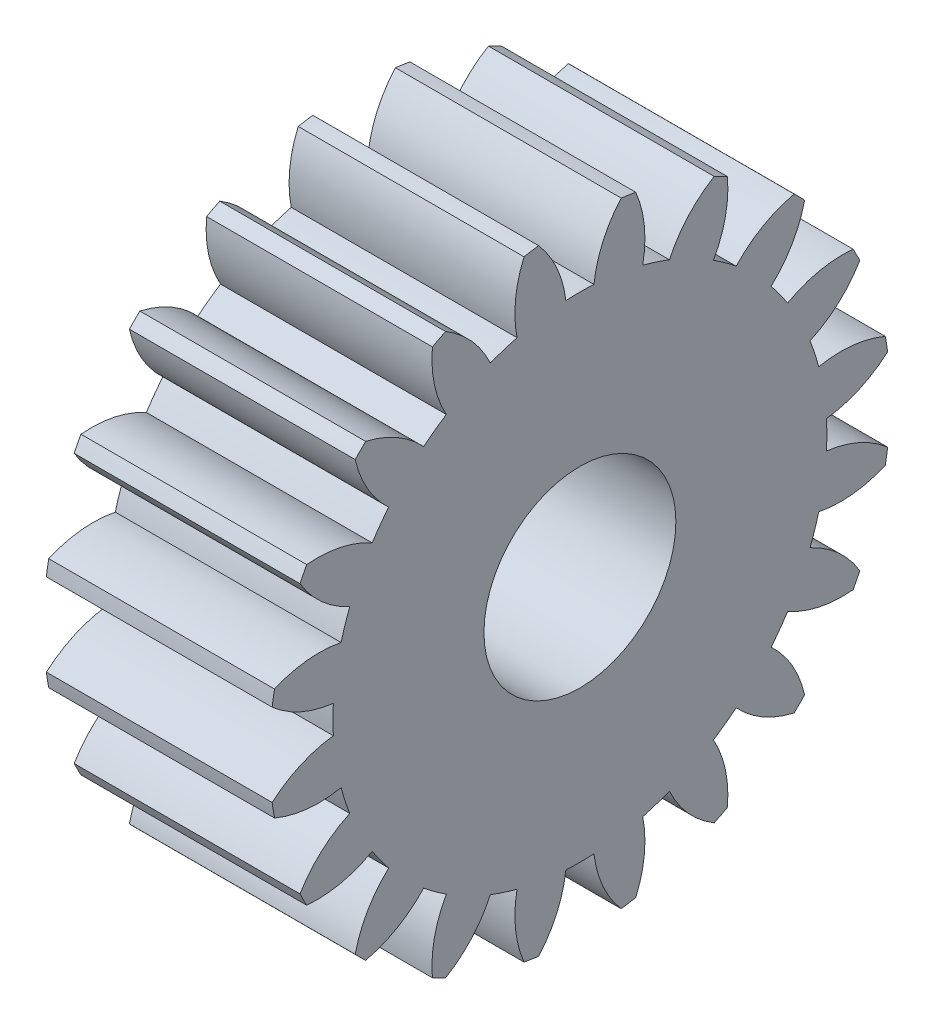
from build123d import *

# Parameters (mm, degrees)
BASPROSKE_W         = 10
BASPROSKE_H         = 13.75
TOOTHCUT_DEPTH      = 22.866069606
TEETHCUTS_COUNT     = 20
TEETHCUTS_ANGLE     = 342
BORSKE_R            = 2
BORE_DEPTH          = 50.0000508
SKETCH2_R           = 2
BOSS_EXTRUDE1_DEPTH = 10
SKETCH3_R           = 4.25
CUT_EXTRUDE2_DEPTH  = 10


with BuildPart() as part:
    # BasProSke → Base-Revolve (revolve)
    with BuildSketch(Plane(origin=(0, 0, 0), x_dir=(1, 0, 0), z_dir=(0, 1, 0)), mode=Mode.PRIVATE) as base_revolve_sk:
        with Locations((5, 6.875)):
            Rectangle(BASPROSKE_W, BASPROSKE_H)
    revolve(base_revolve_sk.sketch.rotate(Axis((-10, 0, 0), (1, 0, 0)), 180), axis=Axis((-10, 0, 0), (1, 0, 0)))

    # TooCutSke → ToothCut (cut, through all)
    with BuildSketch(Plane(origin=(0, 0, 0), x_dir=(0, 0, -1), z_dir=(1, 0, 0))):
        with BuildLine():
            ThreePointArc((0.62110296, 10.918848994), (0, 10.9365), (-0.62110296, 10.918848994))
            ThreePointArc((-0.62110296, 10.918848994), (-1.024517052, 12.378857135), (-1.846615859, 13.651067908))
            ThreePointArc((-1.846615859, 13.651067908), (0, 13.7754), (1.846615859, 13.651067908))
            ThreePointArc((1.846615859, 13.651067908), (1.024517052, 12.378857135), (0.62110296, 10.918848994))
        make_face()
    toothcut = extrude(amount=TOOTHCUT_DEPTH, mode=Mode.SUBTRACT)

    # TeethCuts: ToothCut ×20 about axis
    teethcuts_axis = Axis((-10, 0, 0), (1, 0, 0))
    for i in range(1, TEETHCUTS_COUNT):
        add(toothcut.rotate(teethcuts_axis, i * TEETHCUTS_ANGLE / (TEETHCUTS_COUNT - 1)), mode=Mode.SUBTRACT)

    # BorSke → Bore (cut, symmetric)
    with BuildSketch(Plane(origin=(0, 0, 0), x_dir=(0, 0, -1), z_dir=(1, 0, 0))):
        with Locations(Location((0, 0, 0), (0, 0, 180))):
            Circle(BORSKE_R)
    extrude(amount=BORE_DEPTH, both=True, mode=Mode.SUBTRACT)

    # Sketch2 → Boss-Extrude1 (add)
    with BuildSketch(Plane(origin=(10, 0, 0), x_dir=(0, 0, -1), z_dir=(1, 0, 0))):
        Circle(SKETCH2_R)
    extrude(amount=-BOSS_EXTRUDE1_DEPTH)

    # Sketch3 → Cut-Extrude2 (cut)
    with BuildSketch(Plane(origin=(10, 0, 0), x_dir=(0, 0, -1), z_dir=(1, 0, 0))):
        Circle(SKETCH3_R)
    extrude(amount=-CUT_EXTRUDE2_DEPTH, mode=Mode.SUBTRACT)


solid = part.part
